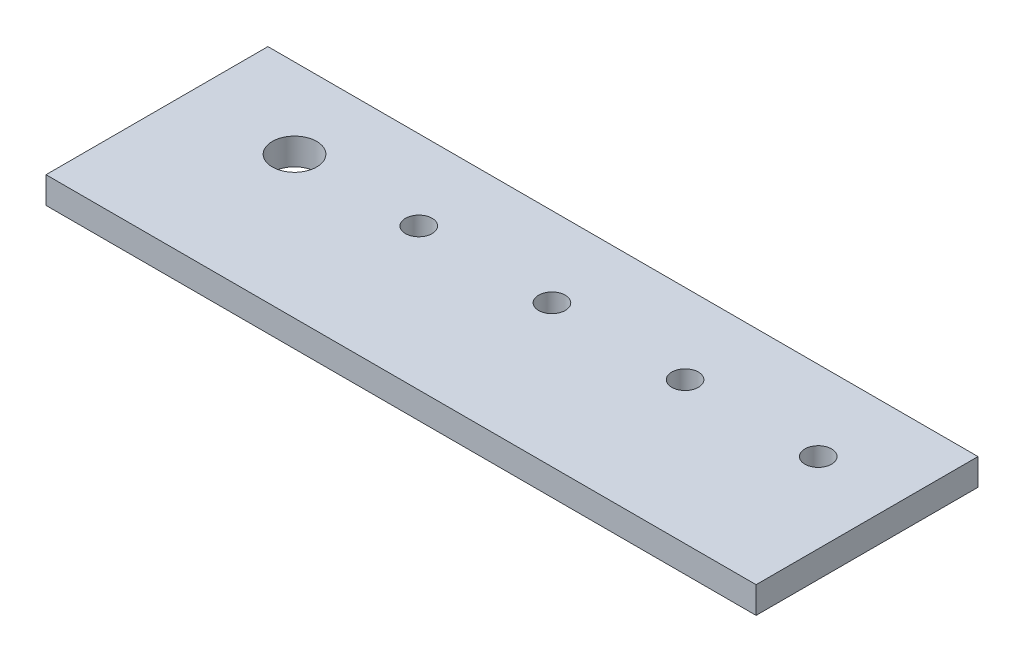
from build123d import *

# Parameters (mm, degrees)
SKETCH1_W                   = 80
SKETCH1_H                   = 25
BOSS_EXTRUDE1_DEPTH         = 3
F_3_0MM_PRESS_DOWEL_HOLE1_D = 3
F_5_0MM_PRESS_DOWEL_HOLE1_D = 5


with BuildPart() as part:
    # Sketch1 → Boss-Extrude1 (new body)
    with BuildSketch(Plane(origin=(0, 0, 0), x_dir=(1, 0, 0), z_dir=(0, 1, 0))):
        with Locations((40, -12.5)):
            Rectangle(SKETCH1_W, SKETCH1_H)
    extrude(amount=BOSS_EXTRUDE1_DEPTH)

    # Ø3.0mm Press Dowel Hole1 (through all)
    with Locations(Plane(origin=(0, 3, 0), x_dir=(1, 0, 0), z_dir=(0, 1, 0))):
        with Locations((71, -9), (56, -9), (41, -9), (26, -9)):
            Hole(F_3_0MM_PRESS_DOWEL_HOLE1_D / 2)

    # Ø5.0mm Press Dowel Hole1 (through all)
    with Locations(Plane(origin=(0, 3, 0), x_dir=(1, 0, 0), z_dir=(0, 1, 0))):
        with Locations((12, -9)):
            Hole(F_5_0MM_PRESS_DOWEL_HOLE1_D / 2)


solid = part.part
